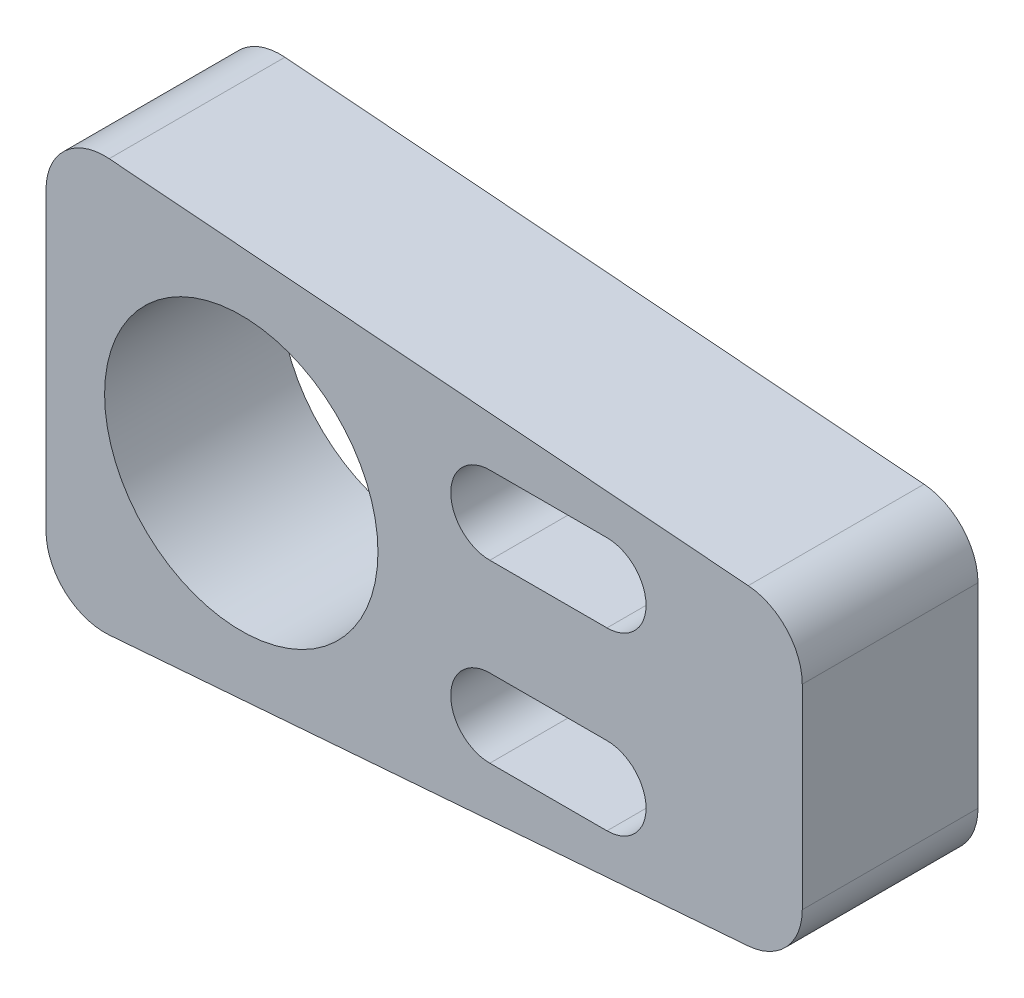
from build123d import *

# Parameters (mm, degrees)
SKETCH1_R           = 7
BOSS_EXTRUDE1_DEPTH = 9


with BuildPart() as part:
    # Sketch1 → Boss-Extrude1 (new body)
    with BuildSketch(Plane.XY):
        with BuildLine():
            Line((-139.941431307, -10.562383746), (-107.213509245, -7.990781577))
            ThreePointArc((-107.213509245, -7.990781577), (-105.245670948, -7.03654075), (-104.448510428, -5))
            Line((-104.448510428, -5), (-104.448510428, 5))
            ThreePointArc((-104.448510428, 5), (-105.245670948, 7.03654075), (-107.213509245, 7.990781577))
            Line((-107.213509245, 7.990781577), (-139.941431307, 10.562383746))
            ThreePointArc((-139.941431307, 10.562383746), (-142.212973239, 9.774441649), (-143.176432489, 7.571602169))
            Line((-143.176432489, 7.571602169), (-143.176432489, -7.571602169))
            ThreePointArc((-143.176432489, -7.571602169), (-142.212973239, -9.774441649), (-139.941431307, -10.562383746))
        make_face()
        with Locations((-133.176432489, 0)):
            Circle(SKETCH1_R, mode=Mode.SUBTRACT)
        with BuildLine():
            Line((-114.448510428, -6.5), (-120.448510428, -6.5))
            ThreePointArc((-120.448510428, -6.5), (-122.448510428, -4.5), (-120.448510428, -2.5))
            Line((-120.448510428, -2.5), (-114.448510428, -2.5))
            ThreePointArc((-114.448510428, -2.5), (-112.448510428, -4.5), (-114.448510428, -6.5))
        make_face(mode=Mode.SUBTRACT)
        with BuildLine():
            Line((-114.448510428, 2.5), (-120.448510428, 2.5))
            ThreePointArc((-120.448510428, 2.5), (-122.448510428, 4.5), (-120.448510428, 6.5))
            Line((-120.448510428, 6.5), (-114.448510428, 6.5))
            ThreePointArc((-114.448510428, 6.5), (-112.448510428, 4.5), (-114.448510428, 2.5))
        make_face(mode=Mode.SUBTRACT)
    extrude(amount=BOSS_EXTRUDE1_DEPTH)


solid = part.part
